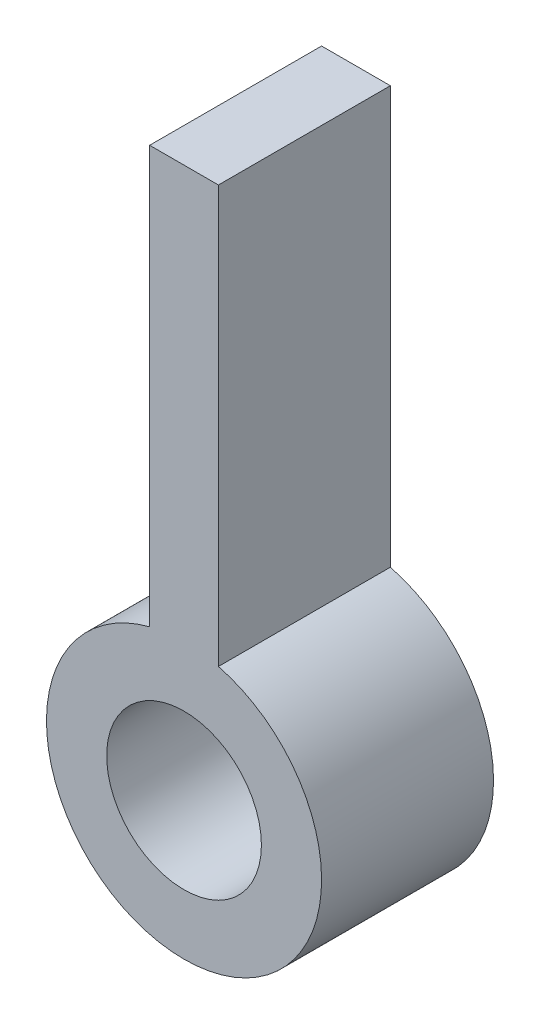
from build123d import *

# Parameters (mm, degrees)
SKETCH2_R           = 2.25
BOSS_EXTRUDE2_DEPTH = 5


with BuildPart() as part:
    # Sketch2 → Boss-Extrude2 (new body)
    with BuildSketch(Plane(origin=(0, 0, 0), x_dir=(0, 1, 0), z_dir=(0, 0, 1))):
        with BuildLine():
            Line((3.872983346, 1), (16, 1))
            Line((16, 1), (16, -1))
            Line((16, -1), (3.872983346, -1))
            ThreePointArc((3.872983346, -1), (-4, 0), (3.872983346, 1))
        make_face()
        with Locations(Location((0, 0, 0), (0, 0, 270))):
            Circle(SKETCH2_R, mode=Mode.SUBTRACT)
    extrude(amount=BOSS_EXTRUDE2_DEPTH)


solid = part.part
